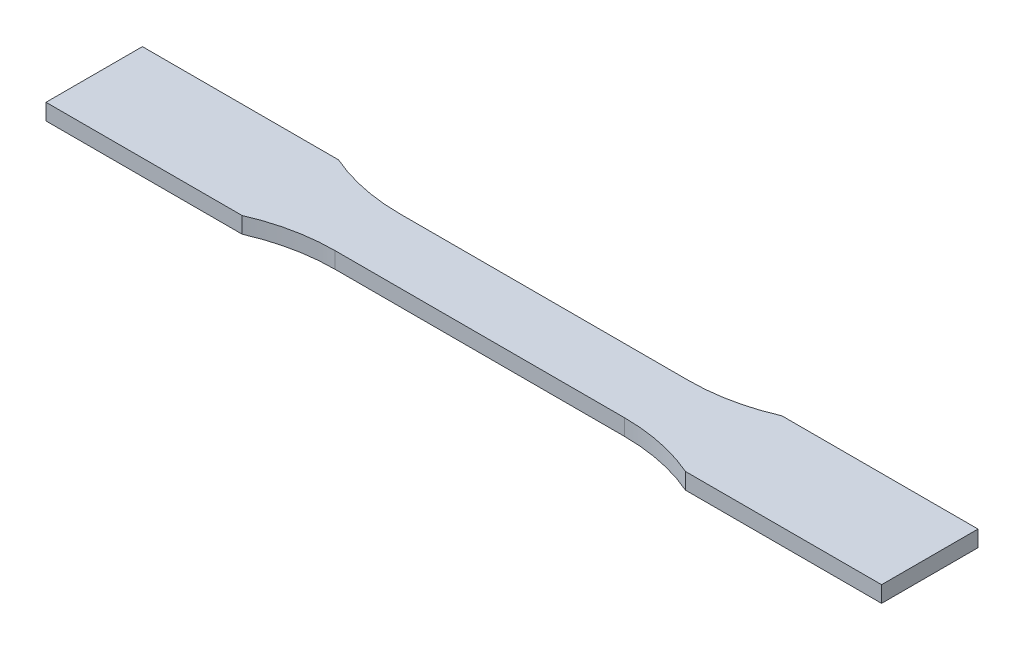
from build123d import *

# Parameters (mm, degrees)
SKETCH1_W           = 57.15
SKETCH1_H           = 12.7
BOSS_EXTRUDE1_DEPTH = 3.2


with BuildPart() as part:
    # Sketch1 → Boss-Extrude1 (new body)
    with BuildSketch(Plane(origin=(0, 0, 0), x_dir=(1, 0, 0), z_dir=(0, 1, 0))):
        with BuildLine():
            Line((-28.575, -6.35), (-28.575, 6.35))
            ThreePointArc((-28.575, 6.35), (-36.352129933, 7.152195105), (-43.801765087, 9.525))
            Line((-43.801765087, 9.525), (-82.55, 9.525))
            Line((-82.55, 9.525), (-82.55, -9.525))
            Line((-82.55, -9.525), (-43.801765087, -9.525))
            ThreePointArc((-43.801765087, -9.525), (-36.352129933, -7.152195105), (-28.575, -6.35))
        make_face()
        Rectangle(SKETCH1_W, SKETCH1_H)
        with BuildLine():
            ThreePointArc((43.801765087, 9.525), (36.352129933, 7.152195105), (28.575, 6.35))
            Line((28.575, 6.35), (28.575, -6.35))
            ThreePointArc((28.575, -6.35), (36.352129933, -7.152195105), (43.801765087, -9.525))
            Line((43.801765087, -9.525), (82.55, -9.525))
            Line((82.55, -9.525), (82.55, 9.525))
            Line((82.55, 9.525), (43.801765087, 9.525))
        make_face()
    extrude(amount=BOSS_EXTRUDE1_DEPTH)


solid = part.part
